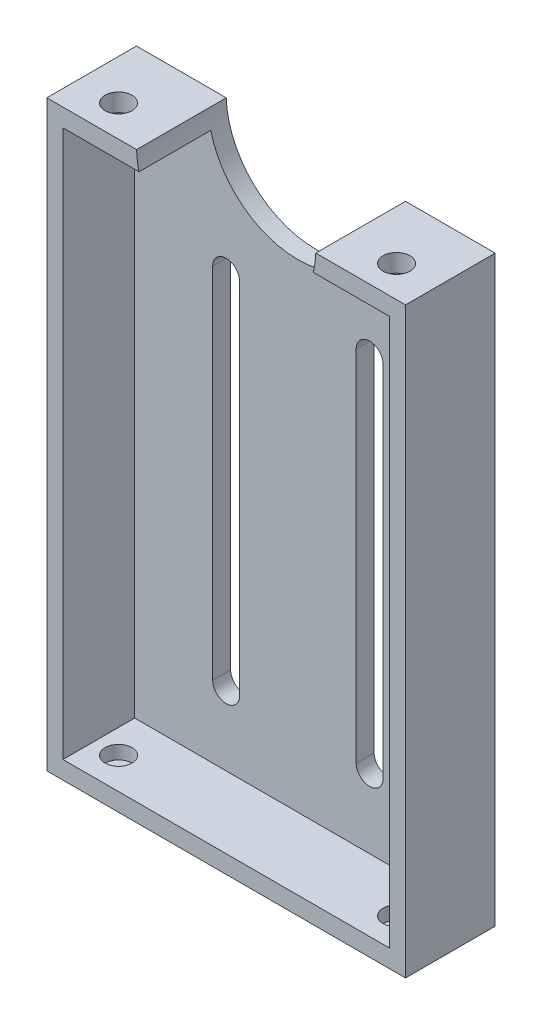
from build123d import *

# Parameters (mm, degrees)
BOSS_EXTRUDE1_DEPTH = 2
BOSS_EXTRUDE2_DEPTH = 8
SKETCH5_R           = 1.5
CUT_EXTRUDE1_DEPTH  = 2
SKETCH6_R           = 1.5
CUT_EXTRUDE2_DEPTH  = 1.5


with BuildPart() as part:
    # Sketch1 → Boss-Extrude1 (new body)
    with BuildSketch(Plane.XY):
        with BuildLine():
            Line((-20, 32.5), (-9.993180492, 32.5))
            ThreePointArc((-9.993180492, 32.5), (0, 22.869247409), (9.993180492, 32.5))
            Line((9.993180492, 32.5), (20, 32.5))
            Line((20, 32.5), (20, -32.5))
            Line((20, -32.5), (-20, -32.5))
            Line((-20, -32.5), (-20, 32.5))
        make_face()
        with BuildLine():
            Line((-6.5, 17.5), (-6.5, -22.5))
            ThreePointArc((-6.5, -22.5), (-8, -24), (-9.5, -22.5))
            Line((-9.5, -22.5), (-9.5, 17.5))
            ThreePointArc((-9.5, 17.5), (-8, 19), (-6.5, 17.5))
        make_face(mode=Mode.SUBTRACT)
        with BuildLine():
            Line((6.5, 17.5), (6.5, -22.5))
            ThreePointArc((6.5, -22.5), (8, -24), (9.5, -22.5))
            Line((9.5, -22.5), (9.5, 17.5))
            ThreePointArc((9.5, 17.5), (8, 19), (6.5, 17.5))
        make_face(mode=Mode.SUBTRACT)
    extrude(amount=BOSS_EXTRUDE1_DEPTH)

    # Sketch2 → Boss-Extrude2 (add)
    with BuildSketch(Plane.XY.offset(2)):
        with BuildLine():
            Line((-20, 32.5), (-9.993180492, 32.5))
            ThreePointArc((-9.993180492, 32.5), (-9.904839947, 31.492967776), (-9.715280064, 30.5))
            Line((-9.715280064, 30.5), (-18.2, 30.5))
            Line((-18.2, 30.5), (-18.2, -30.5))
            Line((-18.2, -30.5), (18.2, -30.5))
            Line((18.2, -30.5), (18.2, 30.5))
            Line((18.2, 30.5), (9.715280064, 30.5))
            ThreePointArc((9.715280064, 30.5), (9.904839947, 31.492967776), (9.993180492, 32.5))
            Line((9.993180492, 32.5), (20, 32.5))
            Line((20, 32.5), (20, 30.5))
            Line((20, 30.5), (20, -30.5))
            Line((20, -30.5), (20, -32.5))
            Line((20, -32.5), (-20, -32.5))
            Line((-20, -32.5), (-20, -30.5))
            Line((-20, -30.5), (-20, 30.5))
            Line((-20, 30.5), (-20, 32.5))
        make_face()
    extrude(amount=BOSS_EXTRUDE2_DEPTH)

    # Sketch5 → Cut-Extrude1 (cut)
    with BuildSketch(Plane(origin=(0, 32.5, 0), x_dir=(1, 0, 0), z_dir=(0, 1, 0))):
        with Locations(Location((-15.5, -6.5, 0), (0, 0, 270))):
            Circle(SKETCH5_R)
        with Locations(Location((15.5, -6.5, 0), (0, 0, 90))):
            Circle(SKETCH5_R)
    extrude(amount=-CUT_EXTRUDE1_DEPTH, mode=Mode.SUBTRACT)

    # Sketch6 → Cut-Extrude2 (cut)
    with BuildSketch(Plane(origin=(0, -30.5, 0), x_dir=(1, 0, 0), z_dir=(0, 1, 0))):
        with Locations(Location((-15.5, -6.5, 0), (0, 0, 270))):
            Circle(SKETCH6_R)
        with Locations(Location((15.5, -6.5, 0), (0, 0, 90))):
            Circle(SKETCH6_R)
    extrude(amount=-CUT_EXTRUDE2_DEPTH, mode=Mode.SUBTRACT)


solid = part.part
